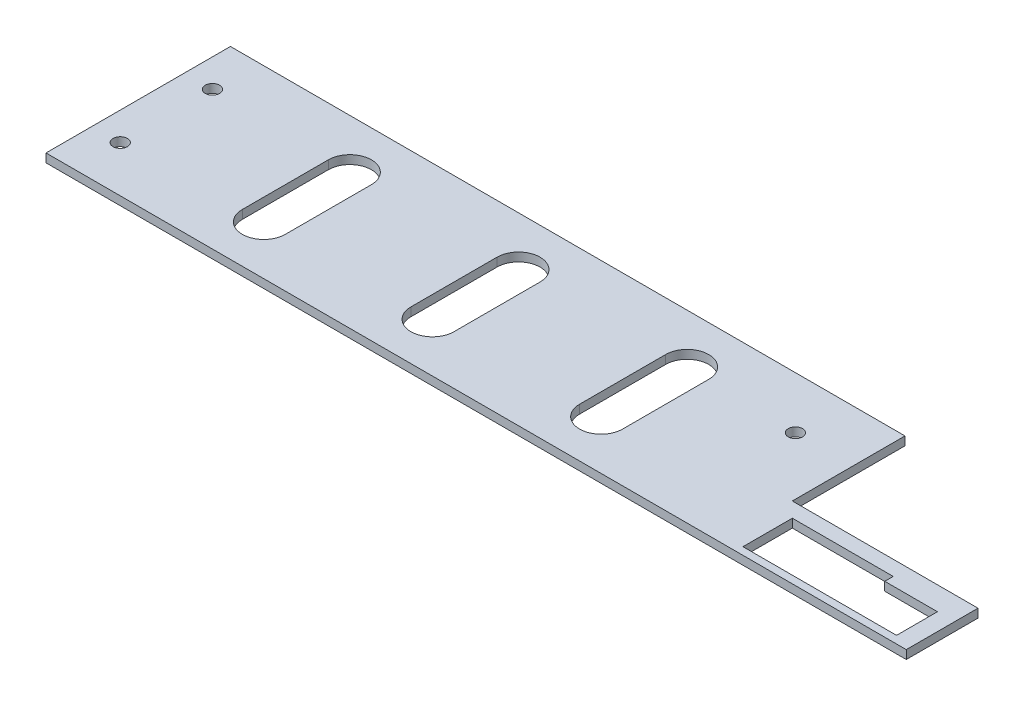
from build123d import *

# Parameters (mm, degrees)
ESQUISSE1_R             = 2.5
BOSS_EXTRU_1_DEPTH      = 3
ENL_V_MAT_EXTRU_1_DEPTH = 166.064843505


with BuildPart() as part:
    # Esquisse1 → Boss.-Extru.1 (new body)
    with BuildSketch(Plane(origin=(0, 0, 0), x_dir=(1, 0, 0), z_dir=(0, 1, 0))):
        Polygon((-161.174292495, 18.77), (-161.174292495, -25.5), (-161.174292495, -35.5), (138.625707505, -35.5), (138.625707505, -10.5), (73.911950915, -10.5), (73.911950915, 28.77), (-161.174292495, 28.77), align=None)
        with Locations(Location((-151.374292495, -19.4325, 0), (0, 0, 270))):
            Circle(ESQUISSE1_R, mode=Mode.SUBTRACT)
        with Locations(Location((-151.374292495, 12.7025, 0), (0, 0, 270))):
            Circle(ESQUISSE1_R, mode=Mode.SUBTRACT)
        with Locations(Location((53.861950915, 10.635, 0), (0, 0, 270))):
            Circle(ESQUISSE1_R, mode=Mode.SUBTRACT)
        Polygon((114.261515644, -15.687745544), (114.261515644, -18.634239014), (132.625707505, -18.634239014), (132.625707505, -32.887044638), (114.261515644, -32.887044638), (79.109163313, -32.887044638), (79.109163313, -15.687745544), align=None, mode=Mode.SUBTRACT)
    extrude(amount=BOSS_EXTRU_1_DEPTH)

    # Esquisse2 → Enlèv. mat.-Extru.1 (cut, through all)
    with BuildSketch(Plane.XZ):
        with BuildLine():
            Line((7.640390062, -11.635), (7.640390062, 18.365))
            ThreePointArc((7.640390062, 18.365), (15.140390062, 25.865), (22.640390062, 18.365))
            Line((22.640390062, 18.365), (22.640390062, -11.635))
            ThreePointArc((22.640390062, -11.635), (15.140390062, -19.135), (7.640390062, -11.635))
        make_face()
        with BuildLine():
            Line((-51.13117079, -11.635), (-51.13117079, 18.365))
            ThreePointArc((-51.13117079, 18.365), (-43.63117079, 25.865), (-36.13117079, 18.365))
            Line((-36.13117079, 18.365), (-36.13117079, -11.635))
            ThreePointArc((-36.13117079, -11.635), (-43.63117079, -19.135), (-51.13117079, -11.635))
        make_face()
        with BuildLine():
            Line((-109.902731643, -11.635), (-109.902731643, 18.365))
            ThreePointArc((-109.902731643, 18.365), (-102.402731643, 25.865), (-94.902731643, 18.365))
            Line((-94.902731643, 18.365), (-94.902731643, -11.635))
            ThreePointArc((-94.902731643, -11.635), (-102.402731643, -19.135), (-109.902731643, -11.635))
        make_face()
    extrude(amount=-ENL_V_MAT_EXTRU_1_DEPTH, mode=Mode.SUBTRACT)


solid = part.part
